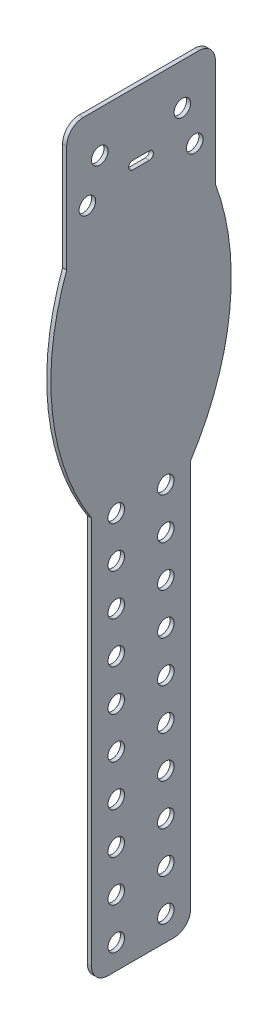
from build123d import *

# Parameters (mm, degrees)
BOSS_EXTRUDE1_DEPTH      = 1
F_4_0_4_DIAMETER_HOLE3_D = 4
F_4_0_4_DIAMETER_HOLE2_D = 4
CUT_EXTRUDE1_DEPTH       = 185.301435156
F_4_0_4_DIAMETER_HOLE1_D = 4
LPATTERN1_COUNT          = 10
LPATTERN1_PITCH          = 10
FILLET1_R                = 4


with BuildPart() as part:
    # Sketch1 → Boss-Extrude1 (new body)
    with BuildSketch(Plane(origin=(0, 0, 0), x_dir=(0, 0, -1), z_dir=(1, 0, 0))):
        with BuildLine():
            Line((12, -183), (12, -85))
            ThreePointArc((12, -85), (21.475099597, -58.206374501), (18, -30))
            Line((18, -30), (18, 0))
            Line((18, 0), (-18, 0))
            Line((-18, 0), (-18, -30))
            ThreePointArc((-18, -30), (-21.475099597, -58.206374501), (-12, -85))
            Line((-12, -85), (-12, -183))
            Line((-12, -183), (12, -183))
        make_face()
    extrude(amount=BOSS_EXTRUDE1_DEPTH)

    # Ø4.0 (4) Diameter Hole3 (through all)
    with Locations(Plane.ZY):
        with Locations((10, -10), (-10, -10)):
            Hole(F_4_0_4_DIAMETER_HOLE3_D / 2)

    # Ø4.0 (4) Diameter Hole2 (through all)
    with Locations(Plane.ZY):
        with Locations((-13, -19), (13, -19)):
            Hole(F_4_0_4_DIAMETER_HOLE2_D / 2)

    # Sketch10 → Cut-Extrude1 (cut, through all)
    with BuildSketch(Plane(origin=(1, 0, 0), x_dir=(0, 0, -1), z_dir=(1, 0, 0))):
        with BuildLine():
            Line((-2, -15), (2, -15))
            ThreePointArc((2, -15), (3, -16), (2, -17))
            Line((2, -17), (-2, -17))
            ThreePointArc((-2, -17), (-3, -16), (-2, -15))
        make_face()
    extrude(amount=-CUT_EXTRUDE1_DEPTH, mode=Mode.SUBTRACT)

    # Ø4.0 (4) Diameter Hole1 (through all)
    with Locations(Plane(origin=(1, 0, 0), x_dir=(0, 0, -1), z_dir=(1, 0, 0))):
        with Locations((-6, -177), (6, -177)):
            f_4_0_4_diameter_hole1 = Hole(F_4_0_4_DIAMETER_HOLE1_D / 2)

    # LPattern1: Ø4.0 (4) Diameter Hole1 ×10
    with Locations(*[(0, i * LPATTERN1_PITCH, 0) for i in range(1, LPATTERN1_COUNT)]):
        add(f_4_0_4_diameter_hole1, mode=Mode.SUBTRACT)

    # Fillet1
    fillet1_edges = [part.edges().sort_by_distance(p)[0] for p in [
        (0.5, 0, 18),
        (0.5, 0, -18),
        (0.5, -183, -12),
        (0.5, -183, 12),
    ]]
    fillet(fillet1_edges, radius=FILLET1_R)


solid = part.part
